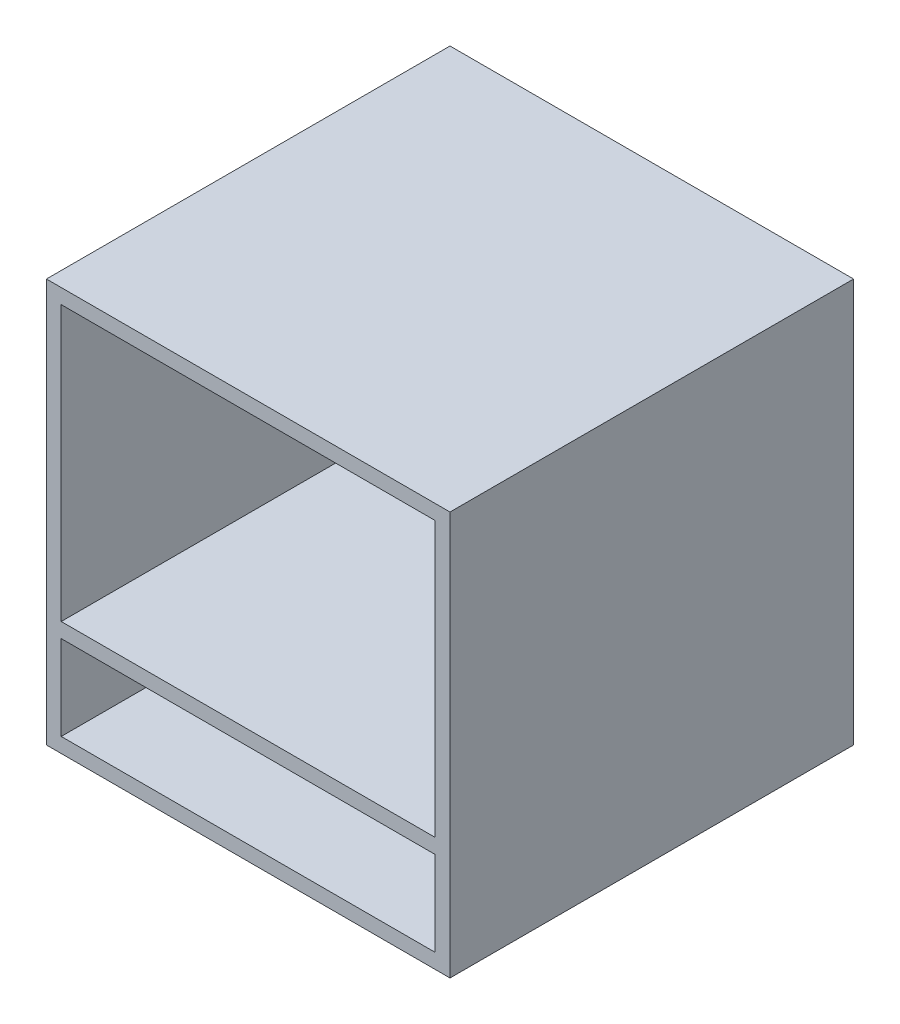
from build123d import *

# Parameters (mm, degrees)
SKETCH_1_W      = 300
SKETCH_1_H      = 300
EXTRUDE_1_DEPTH = 300
SHELL_1_T       = -11
SKETCH_3_W      = 300
SKETCH_3_H      = 11
EXTRUDE_2_DEPTH = 300


with BuildPart() as part:
    # 草图1 → 凸台-拉伸1 (new body)
    with BuildSketch(Plane(origin=(0, 0, 0), x_dir=(1, 0, 0), z_dir=(0, 1, 0))):
        Rectangle(SKETCH_1_W, SKETCH_1_H)
    extrude(amount=EXTRUDE_1_DEPTH)

    # 抽壳1
    shell_1_openings = [part.faces().sort_by_distance(p)[0] for p in [
        (0, 150, 150),
    ]]
    offset(amount=SHELL_1_T, openings=shell_1_openings, kind=Kind.INTERSECTION)

    # 草图3 → 凸台-拉伸2 (add)
    with BuildSketch(Plane.XY.offset(150)):
        with Locations((0, 79.5)):
            Rectangle(SKETCH_3_W, SKETCH_3_H)
    extrude(amount=-EXTRUDE_2_DEPTH)


solid = part.part
